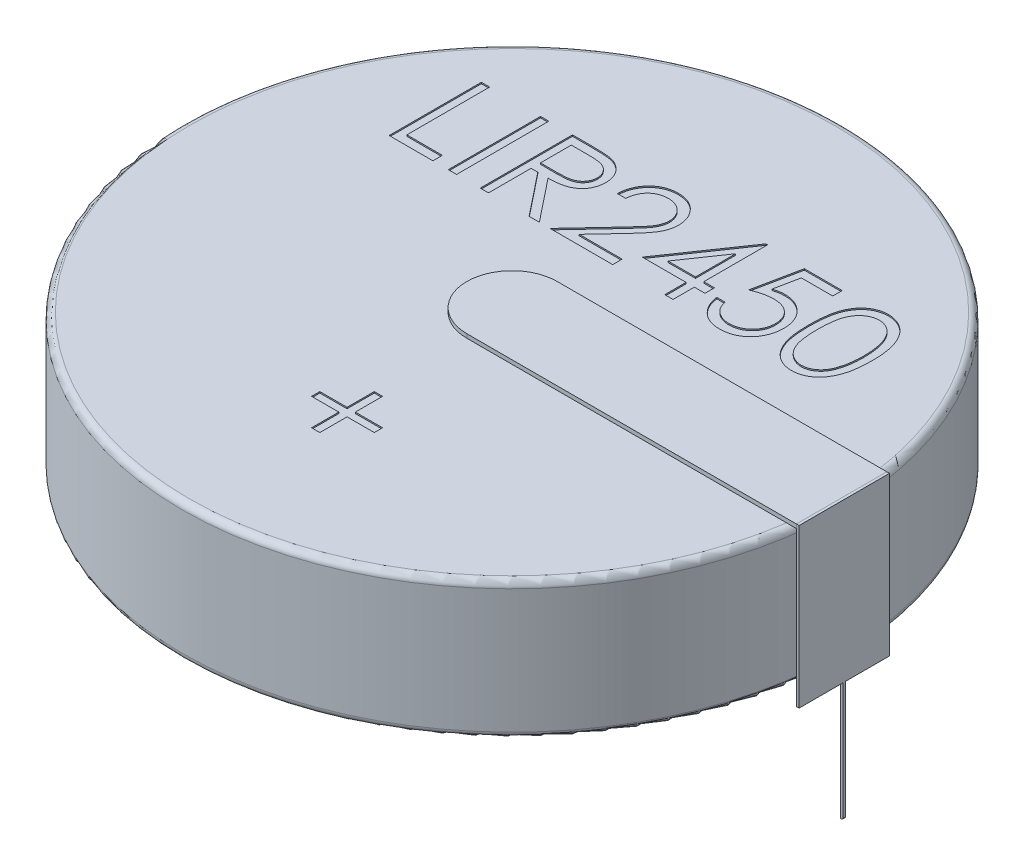
from build123d import *

# Parameters (mm, degrees)
ESQUISSE1_R             = 12.5
BOSS_EXTRU_1_DEPTH      = 5.21
CONG_1_R                = 0.25
CONG_2_R                = 0.25
BOSS_EXTRU_2_DEPTH      = 0.15
ESQUISSE4_W             = 0.103326619
ESQUISSE4_H             = 3.428591526
BOSS_EXTRU_8_DEPTH      = 6
ESQUISSE5_W             = 0.1
ESQUISSE5_H             = 4.5
BOSS_EXTRU_9_DEPTH      = 0.1
CONG_3_R                = 0.05
ESQUISSE8_W             = 5.005952814
ESQUISSE8_H             = 3.395907203
BOSS_EXTRU_11_DEPTH     = 0.1
ESQUISSE10_W            = 0.1
ESQUISSE10_H            = 3.395907203
BOSS_EXTRU_12_DEPTH     = 0.54
ESQUISSE11_W            = 0.1
ESQUISSE11_H            = 4.5
BOSS_EXTRU_13_DEPTH     = 0.1
ESQUISSE12_W            = 0.314102564
ESQUISSE12_H            = 3.5
ENL_V_MAT_EXTRU_1_DEPTH = 0.05
ENL_V_MAT_EXTRU_2_DEPTH = 0.05


with BuildPart() as part:
    # Esquisse1 → Boss.-Extru.1 (new body)
    with BuildSketch(Plane(origin=(0, 0, 0), x_dir=(1, 0, 0), z_dir=(0, 1, 0))):
        with Locations(Location((0, 0, 0), (0, 0, 270))):
            Circle(ESQUISSE1_R)
    extrude(amount=BOSS_EXTRU_1_DEPTH)

    # Congé1
    cong_1_edges = [part.edges().sort_by_distance(p)[0] for p in [
        (0, 5.21, -12.5),
    ]]
    fillet(cong_1_edges, radius=CONG_1_R)

    # Congé2
    cong_2_edges = [part.edges().sort_by_distance(p)[0] for p in [
        (0, 0, -12.5),
    ]]
    fillet(cong_2_edges, radius=CONG_2_R)

    # Esquisse3 → Boss.-Extru.2 (add)
    with BuildSketch(Plane(origin=(0, 5.21, 0), x_dir=(1, 0, 0), z_dir=(0, 1, 0))):
        with BuildLine():
            Line((0, 1.714295763), (12.5, 1.714295763))
            Line((12.5, 1.714295763), (12.5, -1.714295763))
            Line((12.5, -1.714295763), (0, -1.714295763))
            ThreePointArc((0, -1.714295763), (-1.714295763, 0), (0, 1.714295763))
        make_face()
    extrude(amount=BOSS_EXTRU_2_DEPTH)

    # Esquisse8 → Boss.-Extru.11 (add)
    with BuildSketch(Plane.XZ):
        with Locations((-9.997023593, -0.003481143)):
            Rectangle(ESQUISSE8_W, ESQUISSE8_H)
    extrude(amount=BOSS_EXTRU_11_DEPTH)

    # Esquisse10 → Boss.-Extru.12 (add)
    with BuildSketch(Plane.XZ.offset(0.1)):
        with Locations((-12.45, -0.003481143)):
            Rectangle(ESQUISSE10_W, ESQUISSE10_H)
    extrude(amount=BOSS_EXTRU_12_DEPTH)

    # Esquisse11 → Boss.-Extru.13 (add)
    with BuildSketch(Plane.ZY.offset(12.5)):
        with Locations((0, -2.89)):
            Rectangle(ESQUISSE11_W, ESQUISSE11_H)
    extrude(amount=-BOSS_EXTRU_13_DEPTH)

    # Esquisse12 → Enlèv. mat.-Extru.1 (cut)
    # profile 1 of 7: a face of its own
    with BuildSketch(Plane(origin=(0, 5.21, 0), x_dir=(1, 0, 0), z_dir=(0, 1, 0))):
        Polygon((-8.133068795, 6.971792656), (-7.818966231, 6.971792656), (-7.818966231, 3.830767015), (-6.472812385, 3.830767015), (-6.472812385, 3.471792656), (-8.133068795, 3.471792656), align=None)
    # profile 2 of 7: a face of its own
    with BuildSketch(Plane(origin=(0, 5.21, 0), x_dir=(1, 0, 0), z_dir=(0, 1, 0))):
        with Locations((-5.732427769, 5.221792656)):
            Rectangle(ESQUISSE12_W, ESQUISSE12_H)
    # profile 3 of 7: a face of its own
    with BuildSketch(Plane(origin=(0, 5.21, 0), x_dir=(1, 0, 0), z_dir=(0, 1, 0))):
        with BuildLine():
            Line((-4.67794059, 6.971792656), (-3.977519917, 6.971792656))
            add(Edge.make_bspline(
                [(-3.977519917, 6.971792656), (-3.930778788, 6.97163707), (-3.841030644, 6.971338328), (-3.712457373, 6.969672565), (-3.595630276, 6.964898209), (-3.490610437, 6.960789625), (-3.397399782, 6.953297684), (-3.315712491, 6.946137037), (-3.245924794, 6.936763376), (-3.203678942, 6.928057953), (-3.184551167, 6.924116374)],
                knots=[0, 0, 0, 0, 1.410062039, 2.707475311, 3.878576406, 4.937260626, 5.877586885, 6.699081471, 7.410979367, 8, 8, 8, 8], degree=3))
            add(Edge.make_bspline(
                [(-3.184551167, 6.924116374), (-3.158944542, 6.917789608), (-3.108277553, 6.905271045), (-3.035327487, 6.878811444), (-2.965813163, 6.848191819), (-2.900023339, 6.812228099), (-2.838287547, 6.770653319), (-2.779969237, 6.724185197), (-2.724803773, 6.673077991), (-2.675022143, 6.61604315), (-2.628083091, 6.55620664), (-2.588494465, 6.491502883), (-2.554367985, 6.423841356), (-2.527197468, 6.352533938), (-2.505319495, 6.278272166), (-2.489893255, 6.200383369), (-2.480642068, 6.119222394), (-2.479700212, 6.063864485), (-2.479222641, 6.03579506)],
                knots=[0, 0, 0, 0, 1.027469482, 2.033020251, 3.019912614, 3.986113645, 4.951240523, 5.91722682, 6.890402269, 7.87763091, 8.8651537, 9.85103654, 10.82876324, 11.815024772, 12.821070561, 13.842952187, 14.906261191, 16, 16, 16, 16], degree=3))
            add(Edge.make_bspline(
                [(-2.479222641, 6.03579506), (-2.480691639, 5.989159955), (-2.483558035, 5.898162787), (-2.510283139, 5.766101906), (-2.554059658, 5.642912591), (-2.614382947, 5.528749953), (-2.691202423, 5.425839308), (-2.783527214, 5.335448853), (-2.891408826, 5.25980894), (-2.991838142, 5.207356135), (-3.080552341, 5.173763227), (-3.153585654, 5.150126868), (-3.233252631, 5.131864903), (-3.318789966, 5.115504771), (-3.410553622, 5.103153076), (-3.508323661, 5.094106482), (-3.612169813, 5.088452433), (-3.683508882, 5.087610428), (-3.720208218, 5.087177271)],
                knots=[0, 0, 0, 0, 1.260483769, 2.459530307, 3.627416485, 4.787058657, 5.939039949, 7.08810263, 8.267026773, 9.491475466, 10.141966685, 10.831826277, 11.566392101, 12.351337768, 13.187381173, 14.07005841, 15.007169909, 16, 16, 16, 16], degree=3))
            Line((-3.720208218, 5.087177271), (-2.434350846, 3.471792656))
            Line((-2.434350846, 3.471792656), (-2.82277232, 3.471792656))
            Line((-2.82277232, 3.471792656), (-4.108629692, 5.087177271))
            Line((-4.108629692, 5.087177271), (-4.363838026, 5.087177271))
            Line((-4.363838026, 5.087177271), (-4.363838026, 3.471792656))
            Line((-4.363838026, 3.471792656), (-4.67794059, 3.471792656))
            Line((-4.67794059, 3.471792656), (-4.67794059, 6.971792656))
        make_face()
        with BuildLine():
            Line((-4.363838026, 6.612818297), (-4.363838026, 5.44615163))
            Line((-4.363838026, 5.44615163), (-3.723012705, 5.441243778))
            add(Edge.make_bspline(
                [(-3.723012705, 5.441243778), (-3.693092666, 5.441230541), (-3.635099109, 5.441204885), (-3.551198444, 5.445198661), (-3.473078333, 5.449741979), (-3.40103758, 5.456691325), (-3.335044005, 5.465647396), (-3.275130592, 5.476850381), (-3.22119954, 5.489902443), (-3.158301001, 5.510104069), (-3.08806447, 5.542110087), (-3.01173301, 5.588675586), (-2.946730672, 5.647244705), (-2.89181281, 5.714218161), (-2.847683379, 5.78785441), (-2.816571324, 5.867270779), (-2.796828882, 5.950462377), (-2.794500337, 6.007640485), (-2.793325205, 6.036496182)],
                knots=[0, 0, 0, 0, 1.146690395, 2.22261258, 3.21895312, 4.145990853, 4.996080663, 5.770904154, 6.481378293, 7.121626537, 8.300444488, 9.431385265, 10.535395872, 11.636531494, 12.74115979, 13.810798291, 14.895190096, 16, 16, 16, 16], degree=3))
            add(Edge.make_bspline(
                [(-2.793325205, 6.036496182), (-2.794527326, 6.064642755), (-2.796909491, 6.120418994), (-2.81635826, 6.202074904), (-2.849247641, 6.279141854), (-2.893569879, 6.351306339), (-2.947569034, 6.416812075), (-3.010886847, 6.472859228), (-3.081792042, 6.519108693), (-3.14806324, 6.548663073), (-3.207297453, 6.566782927), (-3.258727113, 6.57953409), (-3.316838591, 6.589778559), (-3.381914049, 6.59798662), (-3.45367568, 6.605041565), (-3.532486331, 6.609793343), (-3.617823111, 6.612607207), (-3.676970043, 6.612746296), (-3.707588026, 6.612818297)],
                knots=[0, 0, 0, 0, 1.101028733, 2.181837193, 3.264309656, 4.369019818, 5.486613113, 6.575447106, 7.666700264, 8.788928104, 9.402425223, 10.0903467, 10.862060571, 11.710948788, 12.657782767, 13.684531032, 14.801375019, 16, 16, 16, 16], degree=3))
            Line((-3.707588026, 6.612818297), (-4.363838026, 6.612818297))
        make_face(mode=Mode.SUBTRACT)
    # profile 4 of 7: a face of its own
    with BuildSketch(Plane(origin=(0, 5.21, 0), x_dir=(1, 0, 0), z_dir=(0, 1, 0))):
        with BuildLine():
            Line((-1.581786744, 5.894869579), (-1.895889308, 5.894869579))
            add(Edge.make_bspline(
                [(-1.895889308, 5.894869579), (-1.893842155, 5.936540467), (-1.889821601, 6.018380981), (-1.870993311, 6.137704888), (-1.844052434, 6.251759686), (-1.80596098, 6.3596296), (-1.758654702, 6.462268408), (-1.701924675, 6.559268423), (-1.634730824, 6.650259612), (-1.55852409, 6.734398455), (-1.475755451, 6.811586026), (-1.386449512, 6.878241269), (-1.292604485, 6.93455894), (-1.194505086, 6.981640182), (-1.091044522, 7.016980028), (-0.983161664, 7.043201668), (-0.870382528, 7.058978013), (-0.793542506, 7.060673799), (-0.754463026, 7.061536246)],
                knots=[0, 0, 0, 0, 1.10065271, 2.161652631, 3.183658789, 4.190468796, 5.17591951, 6.163126047, 7.15150782, 8.156236427, 9.156009102, 10.134482811, 11.092018607, 12.041330605, 13.001268258, 13.972401359, 14.968799086, 16, 16, 16, 16], degree=3))
            add(Edge.make_bspline(
                [(-0.754463026, 7.061536246), (-0.716084951, 7.060637789), (-0.640673407, 7.058872354), (-0.530611392, 7.043711325), (-0.425834098, 7.019965733), (-0.326546331, 6.986650317), (-0.233540267, 6.94186589), (-0.146117222, 6.888068351), (-0.063236411, 6.82584852), (0.011370372, 6.752594706), (0.079878451, 6.674392322), (0.138980707, 6.590904418), (0.18959387, 6.504675132), (0.23178155, 6.415046931), (0.262837689, 6.321175902), (0.286415897, 6.2244287), (0.299743311, 6.123803889), (0.301788734, 6.055697333), (0.302828641, 6.021071502)],
                knots=[0, 0, 0, 0, 1.111607364, 2.184268762, 3.212621178, 4.221274766, 5.211760367, 6.196651075, 7.1921475, 8.207485113, 9.220403448, 10.201281604, 11.166441695, 12.114753415, 13.065576456, 14.026450734, 14.996634279, 16, 16, 16, 16], degree=3))
            add(Edge.make_bspline(
                [(0.302828641, 6.021071502), (0.301135378, 5.972323667), (0.297778567, 5.875683454), (0.26906419, 5.733668591), (0.224217679, 5.596075172), (0.170220322, 5.48533787), (0.115747878, 5.396104376), (0.066660371, 5.322635671), (0.00919556, 5.243530203), (-0.057482938, 5.159052865), (-0.13199581, 5.06854196), (-0.215017974, 4.972052165), (-0.307141456, 4.870580395), (-0.371799957, 4.801274794), (-0.405304372, 4.765362367)],
                knots=[0, 0, 0, 0, 1.184426356, 2.348067706, 3.509069118, 4.696110526, 5.333549288, 6.050745305, 6.844228056, 7.710549037, 8.667450064, 9.695053472, 10.805634456, 12, 12, 12, 12], degree=3))
            Line((-0.405304372, 4.765362367), (-1.281005494, 3.830767015))
            Line((-1.281005494, 3.830767015), (0.347700436, 3.830767015))
            Line((0.347700436, 3.830767015), (0.347700436, 3.471792656))
            Line((0.347700436, 3.471792656), (-2.030504692, 3.471792656))
            Line((-2.030504692, 3.471792656), (-0.673132897, 4.920310284))
            add(Edge.make_bspline(
                [(-0.673132897, 4.920310284), (-0.640085011, 4.954808591), (-0.576606783, 5.021072777), (-0.486824207, 5.117815737), (-0.406185218, 5.207565278), (-0.334167826, 5.290151827), (-0.27233432, 5.366783394), (-0.217462088, 5.434978098), (-0.173496497, 5.497732548), (-0.125781102, 5.570473162), (-0.07956712, 5.659285479), (-0.039854764, 5.767819169), (-0.015639916, 5.879546421), (-0.01273508, 5.955048458), (-0.011273923, 5.99302663)],
                knots=[0, 0, 0, 0, 1.329631726, 2.553950428, 3.673215718, 4.687767853, 5.603093632, 6.413772471, 7.123043292, 7.734684054, 8.834405432, 9.900288307, 10.943827018, 12, 12, 12, 12], degree=3))
            add(Edge.make_bspline(
                [(-0.011273923, 5.99302663), (-0.011909665, 6.016908029), (-0.013162591, 6.063973679), (-0.024220289, 6.132979438), (-0.040930795, 6.199544252), (-0.064876053, 6.263872871), (-0.096482793, 6.325318523), (-0.134956173, 6.383956003), (-0.179346236, 6.440644968), (-0.230697506, 6.493798266), (-0.287109025, 6.542479472), (-0.346703275, 6.585603557), (-0.409753379, 6.621642668), (-0.475993502, 6.651186165), (-0.545238971, 6.674361547), (-0.617623716, 6.690420126), (-0.692947732, 6.70050261), (-0.744381228, 6.701866782), (-0.770588827, 6.702561887)],
                knots=[0, 0, 0, 0, 0.991446411, 1.95395049, 2.89581595, 3.838931463, 4.798493298, 5.75982156, 6.748411868, 7.785213223, 8.824556874, 9.840280684, 10.836137867, 11.835679398, 12.848801643, 13.863922112, 14.911575587, 16, 16, 16, 16], degree=3))
            add(Edge.make_bspline(
                [(-0.770588827, 6.702561887), (-0.79795966, 6.701846854), (-0.851711456, 6.700442649), (-0.930630489, 6.690619985), (-1.005916266, 6.673674145), (-1.077758169, 6.65049747), (-1.146277755, 6.621038921), (-1.211141799, 6.584347177), (-1.272204688, 6.540563684), (-1.329581212, 6.490923127), (-1.382445191, 6.435655526), (-1.428892067, 6.374045563), (-1.469476081, 6.307218148), (-1.504885314, 6.235353597), (-1.533641004, 6.157799817), (-1.555614155, 6.074832112), (-1.573001001, 5.986810731), (-1.578809522, 5.926025646), (-1.581786744, 5.894869579)],
                knots=[0, 0, 0, 0, 1.031018746, 2.02475058, 2.990194455, 3.934040569, 4.864654155, 5.795059489, 6.735614925, 7.690564532, 8.649604399, 9.611025574, 10.590972636, 11.591080095, 12.624614302, 13.701020113, 14.821632451, 16, 16, 16, 16], degree=3))
        make_face()
    # profile 5 of 7: a face of its own
    with BuildSketch(Plane(origin=(0, 5.21, 0), x_dir=(1, 0, 0), z_dir=(0, 1, 0))):
        Polygon((2.572359891, 7.061536246), (2.636161974, 7.061536246), (2.636161974, 4.638459323), (3.040008128, 4.638459323), (3.040008128, 4.279484964), (2.636161974, 4.279484964), (2.636161974, 3.471792656), (2.32205941, 3.471792656), (2.32205941, 4.279484964), (0.661803, 4.279484964), align=None)
        Polygon((2.32205941, 4.638459323), (2.32205941, 6.158491374), (1.27879018, 4.638459323), align=None, mode=Mode.SUBTRACT)
    # profile 6 of 7: a face of its own
    with BuildSketch(Plane(origin=(0, 5.21, 0), x_dir=(1, 0, 0), z_dir=(0, 1, 0))):
        with BuildLine():
            Line((5.552828641, 6.971792656), (5.552828641, 6.612818297))
            Line((5.552828641, 6.612818297), (4.362323833, 6.612818297))
            Line((4.362323833, 6.612818297), (4.173722071, 5.69224538))
            add(Edge.make_bspline(
                [(4.173722071, 5.69224538), (4.210777945, 5.702475652), (4.282567841, 5.722295186), (4.388527702, 5.744300956), (4.489119905, 5.7575664), (4.554395276, 5.759377711), (4.585981686, 5.760254194)],
                knots=[0, 0, 0, 0, 1.100273476, 2.13160584, 3.095893838, 4, 4, 4, 4], degree=3))
            add(Edge.make_bspline(
                [(4.585981686, 5.760254194), (4.625065426, 5.759408259), (4.701913823, 5.757744938), (4.81435277, 5.741773088), (4.921685663, 5.716633174), (5.023688033, 5.681512652), (5.120548584, 5.636602919), (5.211376146, 5.580502978), (5.297534059, 5.514969647), (5.377476652, 5.439624635), (5.450000961, 5.356703018), (5.51376695, 5.267545147), (5.567929541, 5.173017485), (5.611490295, 5.072216877), (5.64627463, 4.966257723), (5.669426625, 4.854025141), (5.684843334, 4.736577021), (5.68656572, 4.656272451), (5.687444026, 4.615322303)],
                knots=[0, 0, 0, 0, 1.052922333, 2.070308379, 3.05430497, 4.020497103, 4.973039431, 5.925935799, 6.892292201, 7.88610001, 8.88166317, 9.857072816, 10.836096531, 11.812156883, 12.81219415, 13.836441305, 14.89672472, 16, 16, 16, 16], degree=3))
            add(Edge.make_bspline(
                [(5.687444026, 4.615322303), (5.68677895, 4.586800083), (5.685457788, 4.530141095), (5.6787392, 4.445996895), (5.665803484, 4.363634062), (5.64843576, 4.28304167), (5.625893342, 4.204372298), (5.598604288, 4.12740077), (5.565208261, 4.052606163), (5.528576885, 3.979280768), (5.487330407, 3.909082261), (5.4415519, 3.843433274), (5.393186409, 3.781348993), (5.341145023, 3.72349526), (5.284944028, 3.670252242), (5.225264061, 3.62130396), (5.162581342, 3.57582263), (5.0959261, 3.535654435), (5.026783617, 3.498691479), (4.9541554, 3.468367941), (4.879694699, 3.441257413), (4.802329824, 3.419647886), (4.722236011, 3.402715331), (4.639281236, 3.39121473), (4.553900566, 3.382838293), (4.496025553, 3.382313936), (4.466790981, 3.382049066)],
                knots=[0, 0, 0, 0, 1.056347294, 2.098418968, 3.122841568, 4.141288669, 5.149314143, 6.15115421, 7.162517403, 8.180376062, 9.185164535, 10.17417709, 11.141909838, 12.097768115, 13.052685741, 14.0056014, 14.954263652, 15.917497458, 16.885230207, 17.854509472, 18.828990115, 19.81800267, 20.826176721, 21.857883937, 22.917946725, 24, 24, 24, 24], degree=3))
            add(Edge.make_bspline(
                [(4.466790981, 3.382049066), (4.4319168, 3.382739904), (4.363305969, 3.384099046), (4.262785402, 3.398317531), (4.166070797, 3.418681448), (4.073940696, 3.449317718), (3.985569432, 3.487705012), (3.902146714, 3.536221184), (3.821540938, 3.591200288), (3.747028901, 3.656080641), (3.677872788, 3.726996323), (3.615966279, 3.803953964), (3.560832702, 3.885683406), (3.513354955, 3.97258156), (3.472856934, 4.064420091), (3.441041946, 4.161543092), (3.415363591, 4.263443096), (3.40450017, 4.333596606), (3.398982487, 4.369228553)],
                knots=[0, 0, 0, 0, 1.0467383, 2.05933395, 3.04377827, 4.011590433, 4.970194871, 5.932262533, 6.905835911, 7.896367577, 8.894135286, 9.877477877, 10.858688626, 11.851381753, 12.8477658, 13.868841284, 14.917554742, 16, 16, 16, 16], degree=3))
            Line((3.398982487, 4.369228553), (3.713085051, 4.369228553))
            add(Edge.make_bspline(
                [(3.713085051, 4.369228553), (3.720813609, 4.335852101), (3.735668325, 4.271700706), (3.768274074, 4.181569365), (3.808139949, 4.101250141), (3.855544298, 4.029680558), (3.912094328, 3.96727156), (3.976623757, 3.911654498), (4.04897148, 3.861479369), (4.12936471, 3.819656602), (4.214177789, 3.783987849), (4.302944999, 3.760236154), (4.393249346, 3.743535261), (4.454327716, 3.7418635), (4.485020148, 3.741023425)],
                knots=[0, 0, 0, 0, 1.136247022, 2.183929868, 3.172523383, 4.106158343, 5.02341133, 5.958108904, 6.928429099, 7.938127109, 8.96079061, 9.975095812, 10.982467395, 12, 12, 12, 12], degree=3))
            add(Edge.make_bspline(
                [(4.485020148, 3.741023425), (4.514978592, 3.741844203), (4.573967014, 3.743460321), (4.660778401, 3.755899334), (4.744591275, 3.775056905), (4.824578632, 3.80372676), (4.902140171, 3.838571478), (4.975313942, 3.883286554), (5.046216819, 3.934746572), (5.112644952, 3.993703203), (5.173484402, 4.058672897), (5.227240523, 4.128150291), (5.272017436, 4.202267137), (5.309751545, 4.27974029), (5.338404844, 4.361418847), (5.358845825, 4.446920022), (5.370848884, 4.536455003), (5.372500064, 4.597524312), (5.373341462, 4.628643617)],
                knots=[0, 0, 0, 0, 1.027316725, 2.022795036, 3.002884548, 3.971462791, 4.93288096, 5.914575861, 6.907176829, 7.935150275, 8.956128384, 9.956726525, 10.942570165, 11.921478529, 12.907843606, 13.90538589, 14.932640048, 16, 16, 16, 16], degree=3))
            add(Edge.make_bspline(
                [(5.373341462, 4.628643617), (5.372682982, 4.656719369), (5.371394102, 4.711673658), (5.360863532, 4.792072865), (5.34254656, 4.868145907), (5.31712268, 4.940260141), (5.284843172, 5.008483583), (5.24539686, 5.072886643), (5.198043462, 5.132620477), (5.143951573, 5.18771303), (5.084693532, 5.238557905), (5.01924979, 5.281901992), (4.948989863, 5.318365909), (4.874760263, 5.349833908), (4.794795365, 5.372434653), (4.710678732, 5.389402538), (4.621502024, 5.399217901), (4.560531336, 5.400579789), (4.529190821, 5.401279835)],
                knots=[0, 0, 0, 0, 1.045622112, 2.046656509, 3.013763289, 3.955457236, 4.890082067, 5.820317437, 6.762574623, 7.722996705, 8.69280354, 9.665887285, 10.63943826, 11.638615906, 12.663482002, 13.728887084, 14.832589034, 16, 16, 16, 16], degree=3))
            add(Edge.make_bspline(
                [(4.529190821, 5.401279835), (4.502061892, 5.400699244), (4.446047536, 5.399500471), (4.36012471, 5.390673974), (4.269832987, 5.37643468), (4.175518491, 5.356848432), (4.076897983, 5.331217355), (3.974179582, 5.300502855), (3.867147316, 5.263780856), (3.795029591, 5.236048642), (3.757956846, 5.221792656)],
                knots=[0, 0, 0, 0, 0.817624296, 1.688186739, 2.600797293, 3.572016777, 4.590301741, 5.671205678, 6.80286297, 8, 8, 8, 8], degree=3))
            Line((3.757956846, 5.221792656), (4.116931205, 6.971792656))
            Line((4.116931205, 6.971792656), (5.552828641, 6.971792656))
        make_face()
    # profile 7 of 7: a face of its own
    with BuildSketch(Plane(origin=(0, 5.21, 0), x_dir=(1, 0, 0), z_dir=(0, 1, 0))):
        with BuildLine():
            add(Edge.make_bspline(
                [(6.046418385, 5.220390412), (6.046746403, 5.2764878), (6.047383583, 5.385457784), (6.054472004, 5.544242426), (6.066247346, 5.693202715), (6.082384719, 5.832345781), (6.102022699, 5.961707546), (6.128238186, 6.080942303), (6.158050988, 6.19060191), (6.192603434, 6.291043958), (6.231591223, 6.383621661), (6.274025484, 6.470046862), (6.321590278, 6.550188795), (6.371567191, 6.625326585), (6.425979263, 6.69423028), (6.483278053, 6.757872942), (6.54569993, 6.814783693), (6.611122938, 6.866629995), (6.680139402, 6.912079467), (6.750782068, 6.952112206), (6.823537174, 6.986312073), (6.898603357, 7.013202509), (6.975305915, 7.035413356), (7.053912982, 7.050602303), (7.134554346, 7.060159212), (7.188985781, 7.061072879), (7.21659066, 7.061536246)],
                knots=[0, 0, 0, 0, 1.646270934, 3.197905019, 4.663502075, 6.030701355, 7.308322542, 8.50163776, 9.611534131, 10.641858119, 11.616356847, 12.558055219, 13.465016945, 14.349605745, 15.204443733, 16.039544428, 16.859896111, 17.680448484, 18.487036065, 19.28249412, 20.06191084, 20.843045899, 21.620316918, 22.403196591, 23.190181807, 24, 24, 24, 24], degree=3))
            add(Edge.make_bspline(
                [(7.21659066, 7.061536246), (7.244426139, 7.06104843), (7.299782148, 7.06007832), (7.381622523, 7.050754377), (7.461572205, 7.035283254), (7.539290343, 7.013362279), (7.61541533, 6.986166603), (7.689351737, 6.952079486), (7.761558819, 6.912400618), (7.830889107, 6.865776741), (7.898103722, 6.813794465), (7.961551685, 6.755031796), (8.021238771, 6.690082077), (8.077914076, 6.619640213), (8.129969673, 6.542355128), (8.179543106, 6.459571018), (8.223915142, 6.369840153), (8.266649817, 6.274659685), (8.303536804, 6.171396027), (8.336803049, 6.060631266), (8.363682017, 5.941057079), (8.38607129, 5.813300834), (8.403416186, 5.676893351), (8.416048828, 5.532127035), (8.422721913, 5.378906645), (8.423978614, 5.274148795), (8.424623513, 5.220390412)],
                knots=[0, 0, 0, 0, 0.810914788, 1.612654377, 2.396697861, 3.181598691, 3.963628158, 4.749916497, 5.551656086, 6.361998678, 7.18212741, 8.025565596, 8.878627764, 9.750805457, 10.657531673, 11.591944965, 12.560506719, 13.57287815, 14.630710178, 15.753379473, 16.941251878, 18.199788006, 19.531962791, 20.947069417, 22.433333509, 24, 24, 24, 24], degree=3))
            add(Edge.make_bspline(
                [(8.424623513, 5.220390412), (8.423971928, 5.166866504), (8.422702342, 5.062577352), (8.416123636, 4.910046377), (8.403165004, 4.766048334), (8.386955016, 4.630237871), (8.364504053, 4.503180253), (8.336898887, 4.384435804), (8.306248564, 4.273491732), (8.26841377, 4.171256921), (8.22700306, 4.076305198), (8.181947864, 3.98763805), (8.133678037, 3.904471757), (8.081089292, 3.82747201), (8.025035879, 3.756093353), (7.96431809, 3.69159573), (7.900647505, 3.632425058), (7.833235089, 3.579773431), (7.762823538, 3.533688626), (7.690864461, 3.492474776), (7.616081078, 3.459242081), (7.540168125, 3.43070704), (7.462039759, 3.408906588), (7.381793368, 3.393832732), (7.299837133, 3.383260884), (7.244435567, 3.382454404), (7.21659066, 3.382049066)],
                knots=[0, 0, 0, 0, 1.561518951, 3.042555995, 4.452378317, 5.7783523, 7.031515105, 8.214008947, 9.334062868, 10.386615937, 11.391082383, 12.354592575, 13.286541444, 14.194233754, 15.072674879, 15.931287219, 16.775624067, 17.606195743, 18.42308326, 19.229000347, 20.022332153, 20.807536673, 21.593273796, 22.3848459, 23.188221202, 24, 24, 24, 24], degree=3))
            add(Edge.make_bspline(
                [(7.21659066, 3.382049066), (7.188986546, 3.382515422), (7.134556622, 3.383434984), (7.053904196, 3.392948715), (6.975621753, 3.408244218), (6.899322999, 3.429660822), (6.824616484, 3.455875659), (6.752520197, 3.490029342), (6.682232513, 3.529363411), (6.613940957, 3.574158833), (6.548928796, 3.625480516), (6.486830191, 3.682244804), (6.429205172, 3.745868216), (6.375571076, 3.815346139), (6.324596988, 3.890039381), (6.277707615, 3.970967754), (6.234336761, 4.057810365), (6.19469327, 4.151128275), (6.159544606, 4.252283203), (6.128496898, 4.362432382), (6.103982741, 4.482548018), (6.082999785, 4.611665385), (6.066075402, 4.750339315), (6.054521077, 4.898645094), (6.047379762, 5.056490302), (6.046744692, 5.164760077), (6.046418385, 5.220390412)],
                knots=[0, 0, 0, 0, 0.810891512, 1.598919785, 2.382837074, 3.152667961, 3.926044502, 4.706494248, 5.493654104, 6.291793342, 7.103789334, 7.925228297, 8.761435821, 9.622817696, 10.50288917, 11.416980706, 12.369136599, 13.353924996, 14.394355917, 15.514179734, 16.714354668, 17.994756427, 19.357759367, 20.818452758, 22.365282078, 24, 24, 24, 24], degree=3))
        make_face()
        with BuildLine():
            add(Edge.make_bspline(
                [(6.360520949, 5.221792656), (6.360640396, 5.175043957), (6.360872219, 5.084313912), (6.36692842, 4.952470651), (6.375178652, 4.829500322), (6.385819949, 4.715246786), (6.401622897, 4.610096774), (6.419329685, 4.51332709), (6.440877775, 4.425449853), (6.466372793, 4.345862043), (6.49541189, 4.273212974), (6.527117753, 4.205611759), (6.561178476, 4.142259823), (6.599297627, 4.083726214), (6.64081269, 4.02982005), (6.684785949, 3.979587218), (6.732858533, 3.934790236), (6.799362276, 3.881063381), (6.88715875, 3.825544248), (6.997779206, 3.777198158), (7.111447657, 3.746815701), (7.188598907, 3.742951945), (7.227107487, 3.741023425)],
                knots=[0, 0, 0, 0, 1.459021318, 2.831673884, 4.118529203, 5.306027144, 6.411944654, 7.436330062, 8.375795394, 9.233974572, 10.042671642, 10.816086306, 11.563610507, 12.285937304, 12.993564865, 13.685989202, 14.367179055, 15.041617293, 16.353048772, 17.594441528, 18.799311195, 20, 20, 20, 20], degree=3))
            add(Edge.make_bspline(
                [(7.227107487, 3.741023425), (7.265865159, 3.742621206), (7.343300482, 3.745813469), (7.456434277, 3.776612206), (7.566264547, 3.823081746), (7.652336488, 3.878029251), (7.717819031, 3.93035758), (7.764736021, 3.974972229), (7.80779807, 4.024928096), (7.848640145, 4.078827392), (7.88609922, 4.137699876), (7.920162358, 4.201262451), (7.951245705, 4.269691629), (7.968954751, 4.317461368), (7.97800893, 4.341884803)],
                knots=[0, 0, 0, 0, 1.353760809, 2.704726607, 4.075137775, 5.516104923, 6.260822281, 7.007110065, 7.778089737, 8.566572457, 9.372053459, 10.217411131, 11.088608312, 12, 12, 12, 12], degree=3))
            add(Edge.make_bspline(
                [(7.97800893, 4.341884803), (7.988560697, 4.373114543), (8.009985311, 4.436524307), (8.037597085, 4.534887959), (8.059342485, 4.638090723), (8.07890585, 4.74551584), (8.092258906, 4.857955541), (8.10300672, 4.975061925), (8.109337407, 5.096923287), (8.110122158, 5.179718278), (8.110520949, 5.221792656)],
                knots=[0, 0, 0, 0, 0.884706709, 1.796334032, 2.740027952, 3.714592787, 4.726048262, 5.777819803, 6.87074269, 8, 8, 8, 8], degree=3))
            add(Edge.make_bspline(
                [(8.110520949, 5.221792656), (8.10997076, 5.263860228), (8.108894472, 5.346153393), (8.104780484, 5.466671574), (8.09415691, 5.581139335), (8.082357791, 5.690049807), (8.06496057, 5.79280011), (8.046202763, 5.890250415), (8.02100155, 5.98119344), (7.994081776, 6.067053022), (7.96327138, 6.146853676), (7.929355646, 6.220967463), (7.893133887, 6.289752188), (7.853791646, 6.353019129), (7.811795963, 6.411051672), (7.766038414, 6.462686267), (7.718334041, 6.509523235), (7.651516856, 6.562985804), (7.564042566, 6.617497499), (7.455196918, 6.667663259), (7.341926274, 6.696471552), (7.26535282, 6.700533239), (7.227107487, 6.702561887)],
                knots=[0, 0, 0, 0, 1.31362396, 2.569729283, 3.763502607, 4.902122613, 5.988968491, 7.01645872, 7.998833611, 8.933434873, 9.825090667, 10.667526885, 11.477055099, 12.250526234, 12.991942729, 13.710640831, 14.402115721, 15.076753259, 16.378508321, 17.609869233, 18.806226677, 20, 20, 20, 20], degree=3))
            add(Edge.make_bspline(
                [(7.227107487, 6.702561887), (7.188396895, 6.70053044), (7.11090519, 6.696463846), (6.996457235, 6.667770592), (6.886752883, 6.617757626), (6.799509909, 6.562805254), (6.732646122, 6.510466942), (6.685563429, 6.465080488), (6.641417256, 6.415434234), (6.600749556, 6.361032319), (6.562660273, 6.302566952), (6.527679261, 6.239578187), (6.496161931, 6.171746823), (6.467077395, 6.099130387), (6.441504607, 6.019549443), (6.420410643, 5.931780449), (6.40092359, 5.835318558), (6.387128321, 5.72959905), (6.374864566, 5.615316896), (6.366983218, 5.492039578), (6.36085196, 5.359975198), (6.360633496, 5.268776039), (6.360520949, 5.221792656)],
                knots=[0, 0, 0, 0, 1.207732386, 2.417664972, 3.655092373, 4.956220595, 5.625982001, 6.301752483, 6.994047911, 7.697131622, 8.419323945, 9.170223765, 9.943494443, 10.752040957, 11.610060368, 12.549350801, 13.567764191, 14.679664412, 15.874934091, 17.154273443, 18.533957287, 20, 20, 20, 20], degree=3))
        make_face(mode=Mode.SUBTRACT)
    extrude(amount=-ENL_V_MAT_EXTRU_1_DEPTH, mode=Mode.SUBTRACT)

    # Esquisse13 → Enlèv. mat.-Extru.2 (cut)
    with BuildSketch(Plane(origin=(0, 5.21, 0), x_dir=(1, 0, 0), z_dir=(0, 1, 0))):
        Polygon((-0.003627286, -6.253266601), (-0.003627286, -5.221215319), (0.310475279, -5.221215319), (0.310475279, -6.253266601), (1.342526561, -6.253266601), (1.342526561, -6.567369165), (0.310475279, -6.567369165), (0.310475279, -7.599420447), (-0.003627286, -7.599420447), (-0.003627286, -6.567369165), (-1.035678568, -6.567369165), (-1.035678568, -6.253266601), align=None)
    extrude(amount=-ENL_V_MAT_EXTRU_2_DEPTH, mode=Mode.SUBTRACT)


with BuildPart() as body_2:
    # Esquisse4 → Boss.-Extru.8 (new body)
    with BuildSketch(Plane(origin=(0, 5.36, 0), x_dir=(1, 0, 0), z_dir=(0, 1, 0))):
        with Locations((12.55166331, 0)):
            Rectangle(ESQUISSE4_W, ESQUISSE4_H)
    extrude(amount=-BOSS_EXTRU_8_DEPTH)

    # Esquisse5 → Boss.-Extru.9 (add)
    with BuildSketch(Plane(origin=(12.603326619, 0, 0), x_dir=(0, 0, -1), z_dir=(1, 0, 0))):
        with Locations((0, -2.89)):
            Rectangle(ESQUISSE5_W, ESQUISSE5_H)
    extrude(amount=-BOSS_EXTRU_9_DEPTH)

    # Congé3
    cong_3_edges = [body_2.edges().sort_by_distance(p)[0] for p in [
        (12.603326619, -5.14, 0),
    ]]
    fillet(cong_3_edges, radius=CONG_3_R)


solid = Compound([part.part, body_2.part])
